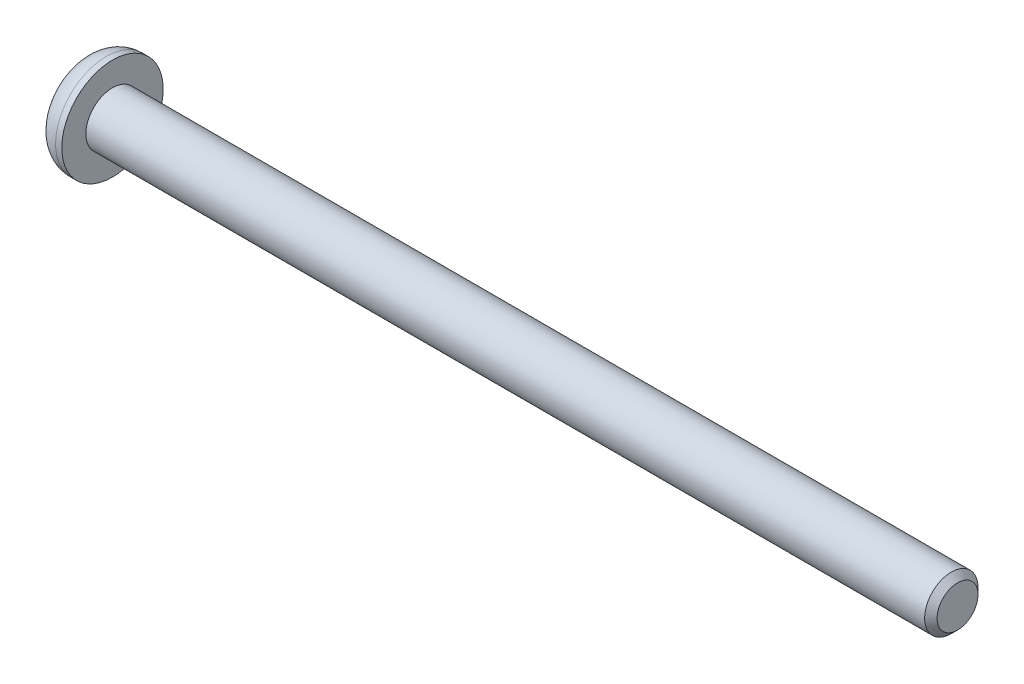
from build123d import *

# Parameters (mm, degrees)
PAH1_SIZE             = 0.7
KES_EKSTR_ZYON1_DEPTH = 1.5


with BuildPart() as part:
    # Çizim1 → Döndür1 (revolve)
    with BuildSketch(Plane.XY, mode=Mode.PRIVATE) as d_nd_r1_sk:
        with BuildLine():
            Line((0, 0), (98.3, 0))
            Line((98.3, 0), (98.3, 3))
            Line((98.3, 3), (3.3, 3))
            Line((3.3, 3), (3.3, 5.7))
            Line((3.3, 5.7), (2.6, 5.7))
            ThreePointArc((2.6, 5.7), (0.671107831, 4.848726189), (0, 2.85))
            Line((0, 2.85), (0, 0))
        make_face()
    revolve(d_nd_r1_sk.sketch.rotate(Axis((0, 0, 0), (1, 0, 0)), 180), axis=Axis((0, 0, 0), (1, 0, 0)))

    # Pah1
    pah1_edges = [part.edges().sort_by_distance(p)[0] for p in [
        (98.3, 3, 0),
    ]]
    chamfer(pah1_edges, length=PAH1_SIZE)

    # Çizim2 → Kes-Ekstrüzyon1 (cut)
    with BuildSketch(Plane.ZY):
        Polygon((0, 1.645448267), (-1.425, 0.822724134), (-1.425, -0.822724134), (0, -1.645448267), (1.425, -0.822724134), (1.425, 0.822724134), align=None)
    extrude(amount=-KES_EKSTR_ZYON1_DEPTH, mode=Mode.SUBTRACT)


solid = part.part
